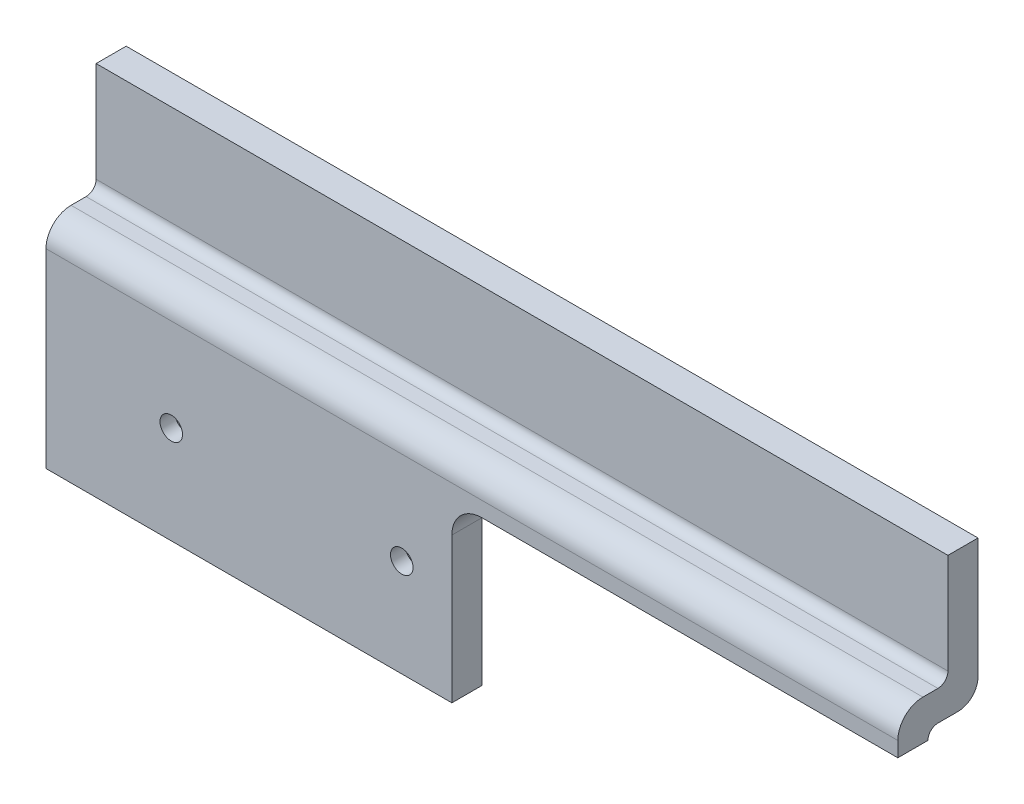
from build123d import *

# Parameters (mm, degrees)
ESTRUSIONE_ESTRUSIONE1_DEPTH                         = 170
FORO_LAMATO_PER_BULLONE_M5_A_TESTA_ESAGO_D           = 4.5
FORO_LAMATO_PER_BULLONE_M5_A_TESTA_ESAGO_DEPTH       = 30
FORO_LAMATO_PER_BULLONE_M5_A_TESTA_ESAGO_CBORE_D     = 10
FORO_LAMATO_PER_BULLONE_M5_A_TESTA_ESAGO_CBORE_DEPTH = 3
FORO_LAMATO_PER_BULLONE_M5_A_TESTA_ESAGO_TIP         = 1.351936393
SCHIZZO4_W                                           = 89
SCHIZZO4_H                                           = 35
TAGLIO_ESTRUSIONE1_DEPTH                             = 170
RACCORDO1_R                                          = 6


with BuildPart() as part:
    # Schizzo1 → Estrusione-Estrusione1 (new body)
    with BuildSketch(Plane(origin=(0, 0, 0), x_dir=(0, 0, -1), z_dir=(1, 0, 0))):
        with BuildLine():
            Line((0, 0), (6, 0))
            Line((6, 0), (6, 35))
            ThreePointArc((6, 35), (6.585786438, 36.414213562), (8, 37))
            Line((8, 37), (12, 37))
            ThreePointArc((12, 37), (14.828427125, 38.171572875), (16, 41))
            Line((16, 41), (16, 65))
            Line((16, 65), (10, 65))
            Line((10, 65), (10, 45))
            ThreePointArc((10, 45), (9.414213562, 43.585786438), (8, 43))
            Line((8, 43), (5, 43))
            ThreePointArc((5, 43), (1.464466094, 41.535533906), (0, 38))
            Line((0, 38), (0, 0))
        make_face()
    extrude(amount=ESTRUSIONE_ESTRUSIONE1_DEPTH)

    # Foro lamato per Bullone M5 a testa esagonale-1
    with Locations(Plane(origin=(0, 0, -6), x_dir=(-1, 0, 0), z_dir=(0, 0, -1))):
        with Locations((-25, 19.5), (-71, 19.5)):
            CounterBoreHole(FORO_LAMATO_PER_BULLONE_M5_A_TESTA_ESAGO_D / 2, FORO_LAMATO_PER_BULLONE_M5_A_TESTA_ESAGO_CBORE_D / 2, FORO_LAMATO_PER_BULLONE_M5_A_TESTA_ESAGO_CBORE_DEPTH, depth=FORO_LAMATO_PER_BULLONE_M5_A_TESTA_ESAGO_DEPTH)
            with Locations((0, 0, -(FORO_LAMATO_PER_BULLONE_M5_A_TESTA_ESAGO_DEPTH + FORO_LAMATO_PER_BULLONE_M5_A_TESTA_ESAGO_TIP / 2))):  # 118° drill point
                Cone(0, FORO_LAMATO_PER_BULLONE_M5_A_TESTA_ESAGO_D / 2, FORO_LAMATO_PER_BULLONE_M5_A_TESTA_ESAGO_TIP, mode=Mode.SUBTRACT)

    # Schizzo4 → Taglio-Estrusione1 (cut)
    with BuildSketch(Plane(origin=(0, 0, -6), x_dir=(-1, 0, 0), z_dir=(0, 0, -1))):
        with Locations((-125.5, 17.5)):
            Rectangle(SCHIZZO4_W, SCHIZZO4_H)
    extrude(amount=-TAGLIO_ESTRUSIONE1_DEPTH, mode=Mode.SUBTRACT)

    # Raccordo1
    raccordo1_edges = [part.edges().sort_by_distance(p)[0] for p in [
        (81, 35, -3),
    ]]
    fillet(raccordo1_edges, radius=RACCORDO1_R)


solid = part.part
